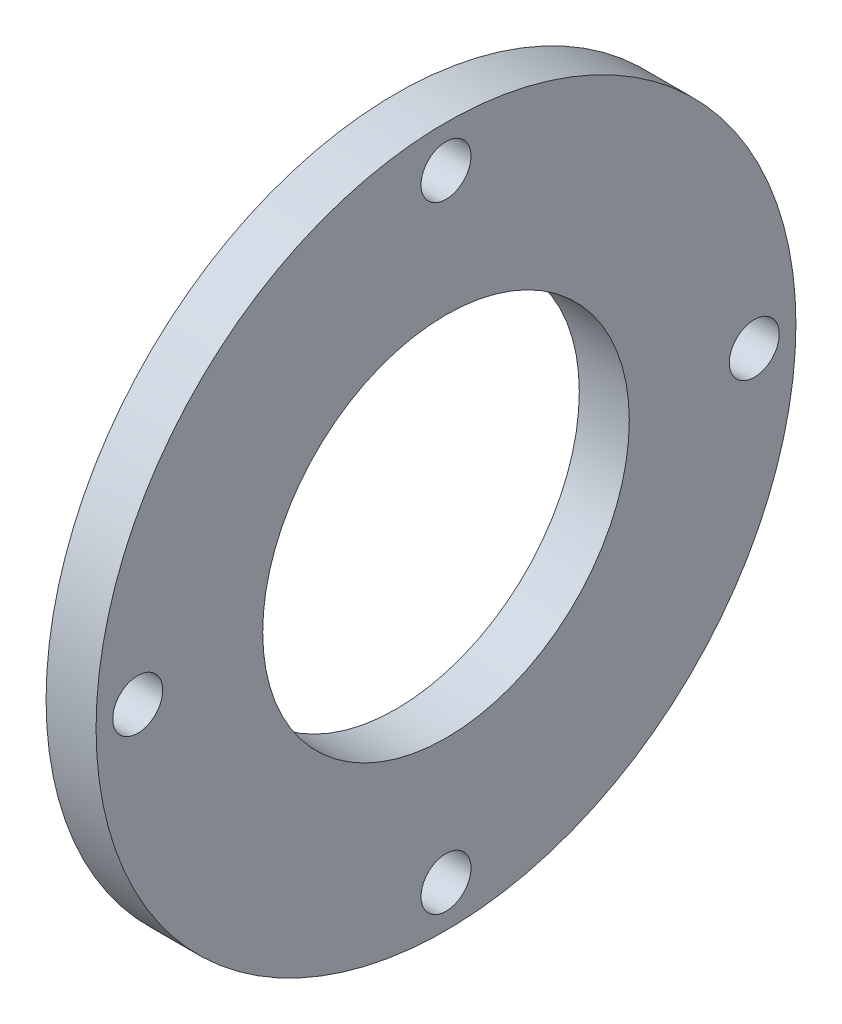
from build123d import *

# Parameters (mm, degrees)
SKETCH1_R           = 21
SKETCH1_R_2         = 11
SKETCH1_R_3         = 1.5
BOSS_EXTRUDE1_DEPTH = 3


with BuildPart() as part:
    # Sketch1 → Boss-Extrude1 (new body)
    with BuildSketch(Plane(origin=(0, 0, 0), x_dir=(0, 0, -1), z_dir=(1, 0, 0))):
        Circle(SKETCH1_R)
        Circle(SKETCH1_R_2, mode=Mode.SUBTRACT)
        with Locations((0, 18.5)):
            Circle(SKETCH1_R_3, mode=Mode.SUBTRACT)
        with Locations((18.5, 0)):
            Circle(SKETCH1_R_3, mode=Mode.SUBTRACT)
        with Locations((0, -18.5)):
            Circle(SKETCH1_R_3, mode=Mode.SUBTRACT)
        with Locations((-18.5, 0)):
            Circle(SKETCH1_R_3, mode=Mode.SUBTRACT)
    extrude(amount=BOSS_EXTRUDE1_DEPTH)


solid = part.part
